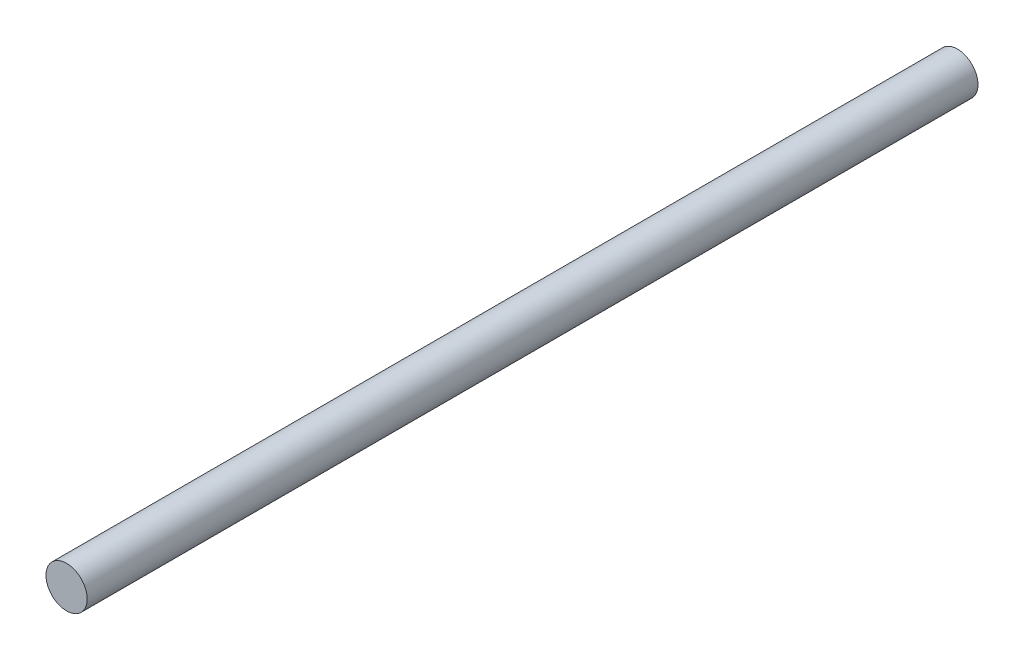
from build123d import *

# Parameters (mm, degrees)
SKETCH1_R           = 4.7625
BOSS_EXTRUDE1_DEPTH = 205.74


with BuildPart() as part:
    # Sketch1 → Boss-Extrude1 (new body)
    with BuildSketch(Plane.XY):
        Circle(SKETCH1_R)
    extrude(amount=BOSS_EXTRUDE1_DEPTH)


solid = part.part
